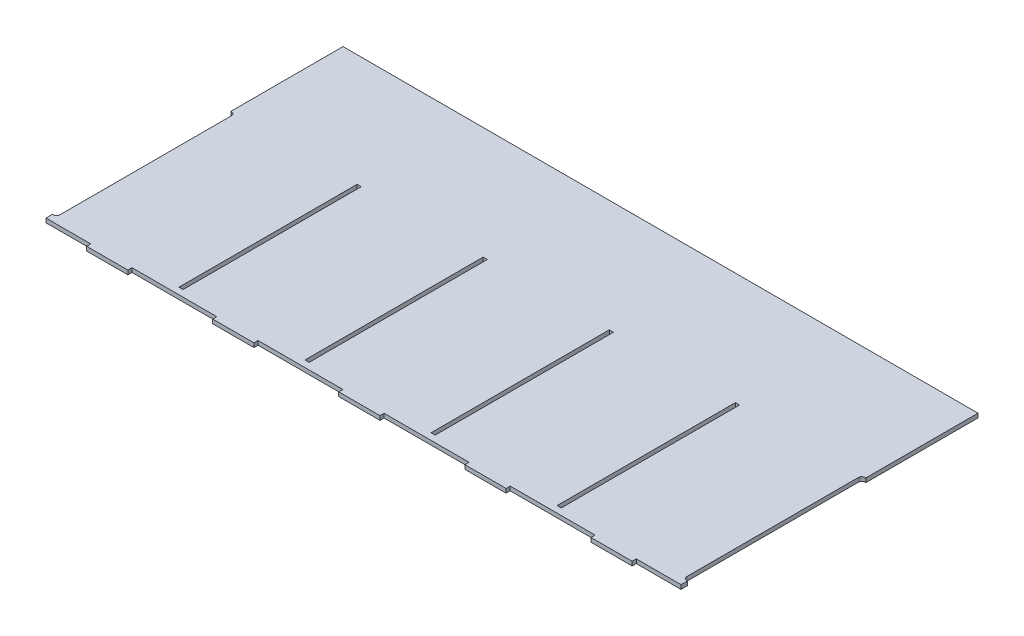
from build123d import *

# Parameters (mm, degrees)
BOSS_EXTRUDE1_DEPTH     = 3.175
CUT_EXTRUDE1_DEPTH      = 272.1390812
CUT_EXTRUDE1_DEPTH_BACK = 272.1390812
CUT_EXTRUDE3_DEPTH      = 272.1390812
CUT_EXTRUDE3_DEPTH_BACK = 272.1390812


with BuildPart() as part:
    # Sketch1 → Boss-Extrude1 (new body)
    with BuildSketch(Plane(origin=(0, 0, 0), x_dir=(1, 0, 0), z_dir=(0, 1, 0))):
        Polygon((-244.348, 114.3), (244.348, 114.3), (244.348, 31.75), (244.348, -114.3), (241.173, -114.3), (209.931, -114.3), (209.931, -117.475), (178.181, -117.475), (178.181, -114.3), (112.903, -114.3), (112.903, -117.475), (81.153, -117.475), (81.153, -114.3), (15.875, -114.3), (15.875, -117.475), (-15.875, -117.475), (-15.875, -114.3), (-81.153, -114.3), (-81.153, -117.475), (-112.903, -117.475), (-112.903, -114.3), (-178.181, -114.3), (-178.181, -117.475), (-209.931, -117.475), (-209.931, -114.3), (-241.173, -114.3), (-244.348, -114.3), (-244.348, 31.75), align=None)
    extrude(amount=BOSS_EXTRUDE1_DEPTH)

    # Sketch2 → Cut-Extrude1 (cut, two sides: drawn at the far end of the back side and taken through both)
    with BuildSketch(Plane(origin=(0, 3.175, 0), x_dir=(1, 0, 0), z_dir=(0, 1, 0)).offset(-CUT_EXTRUDE1_DEPTH_BACK)):
        with BuildLine():
            Line((244.348, 27.94), (243.713, 27.94))
            ThreePointArc((243.713, 27.94), (241.916948776, 27.196051224), (241.173, 25.4))
            Line((241.173, 25.4), (241.173, -106.68))
            ThreePointArc((241.173, -106.68), (241.916948776, -108.476051224), (243.713, -109.22))
            Line((243.713, -109.22), (244.348, -109.22))
            Line((244.348, -109.22), (244.348, 27.94))
        make_face()
        with BuildLine():
            Line((-243.713, -109.22), (-244.348, -109.22))
            Line((-244.348, -109.22), (-244.348, 27.94))
            Line((-244.348, 27.94), (-243.713, 27.94))
            ThreePointArc((-243.713, 27.94), (-241.916948776, 27.196051224), (-241.173, 25.4))
            Line((-241.173, 25.4), (-241.173, -106.68))
            ThreePointArc((-241.173, -106.68), (-241.916948776, -108.476051224), (-243.713, -109.22))
        make_face()
    extrude(amount=CUT_EXTRUDE1_DEPTH + CUT_EXTRUDE1_DEPTH_BACK, mode=Mode.SUBTRACT)

    # Sketch4 → Cut-Extrude3 (cut, two sides: drawn at the far end of the back side and taken through both)
    with BuildSketch(Plane(origin=(0, 3.175, 0), x_dir=(1, 0, 0), z_dir=(0, 1, 0)).offset(-CUT_EXTRUDE3_DEPTH_BACK)):
        Polygon((-145.542, 27.94), (-147.1295, 27.94), (-147.1295, -109.22), (-145.542, -109.22), (-143.9545, -109.22), (-143.9545, 27.94), align=None)
        Polygon((-50.1015, -109.22), (-48.514, -109.22), (-46.9265, -109.22), (-46.9265, 27.94), (-48.514, 27.94), (-50.1015, 27.94), align=None)
        Polygon((46.9265, -109.22), (48.514, -109.22), (50.1015, -109.22), (50.1015, 27.94), (48.514, 27.94), (46.9265, 27.94), align=None)
        Polygon((143.9545, -109.22), (145.542, -109.22), (147.1295, -109.22), (147.1295, 27.94), (145.542, 27.94), (143.9545, 27.94), align=None)
    extrude(amount=CUT_EXTRUDE3_DEPTH + CUT_EXTRUDE3_DEPTH_BACK, mode=Mode.SUBTRACT)


solid = part.part
